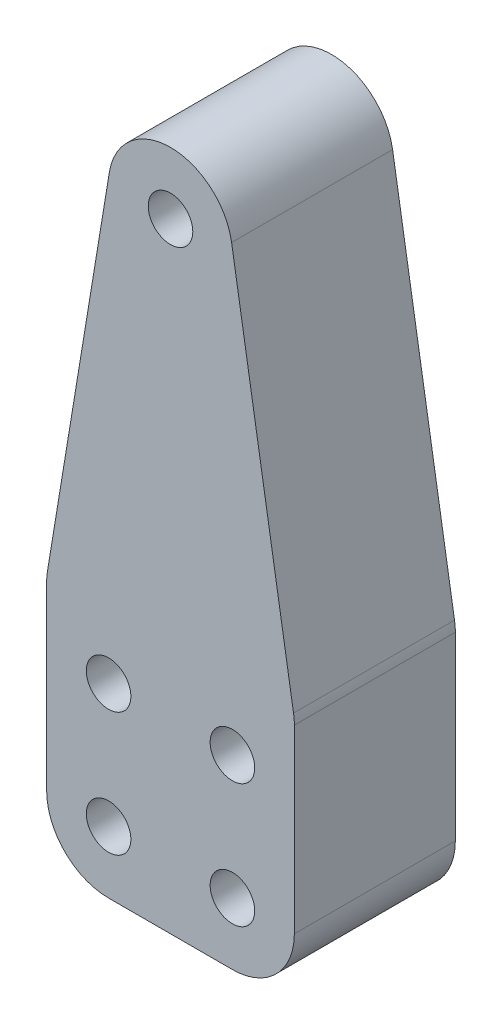
from build123d import *

# Parameters (mm, degrees)
SKETCH1_R           = 2.286
BOSS_EXTRUDE1_DEPTH = 16.51
FILLET1_R           = 6.35


with BuildPart() as part:
    # Sketch1 → Boss-Extrude1 (new body)
    with BuildSketch(Plane.XY):
        with BuildLine():
            Line((-12.7, 12.7), (-6.265860593, 51.830286864))
            ThreePointArc((-6.265860593, 51.830286864), (0, 57.15), (6.265860593, 51.830286864))
            Line((6.265860593, 51.830286864), (12.7, 12.7))
            Line((12.7, 12.7), (12.7, -12.7))
            Line((12.7, -12.7), (-12.7, -12.7))
            Line((-12.7, -12.7), (-12.7, 12.7))
        make_face()
        with Locations((-6.35, -6.35)):
            Circle(SKETCH1_R, mode=Mode.SUBTRACT)
        with Locations((0, 50.8)):
            Circle(SKETCH1_R, mode=Mode.SUBTRACT)
        with Locations((6.35, -6.35)):
            Circle(SKETCH1_R, mode=Mode.SUBTRACT)
        with Locations((6.35, 6.35)):
            Circle(SKETCH1_R, mode=Mode.SUBTRACT)
        with Locations((-6.35, 6.35)):
            Circle(SKETCH1_R, mode=Mode.SUBTRACT)
    extrude(amount=BOSS_EXTRUDE1_DEPTH)

    # Fillet1
    fillet1_edges = [part.edges().sort_by_distance(p)[0] for p in [
        (-12.7, 12.7, 8.255),
        (12.7, 12.7, 8.255),
        (12.7, -12.7, 8.255),
        (-12.7, -12.7, 8.255),
    ]]
    fillet(fillet1_edges, radius=FILLET1_R)


solid = part.part
